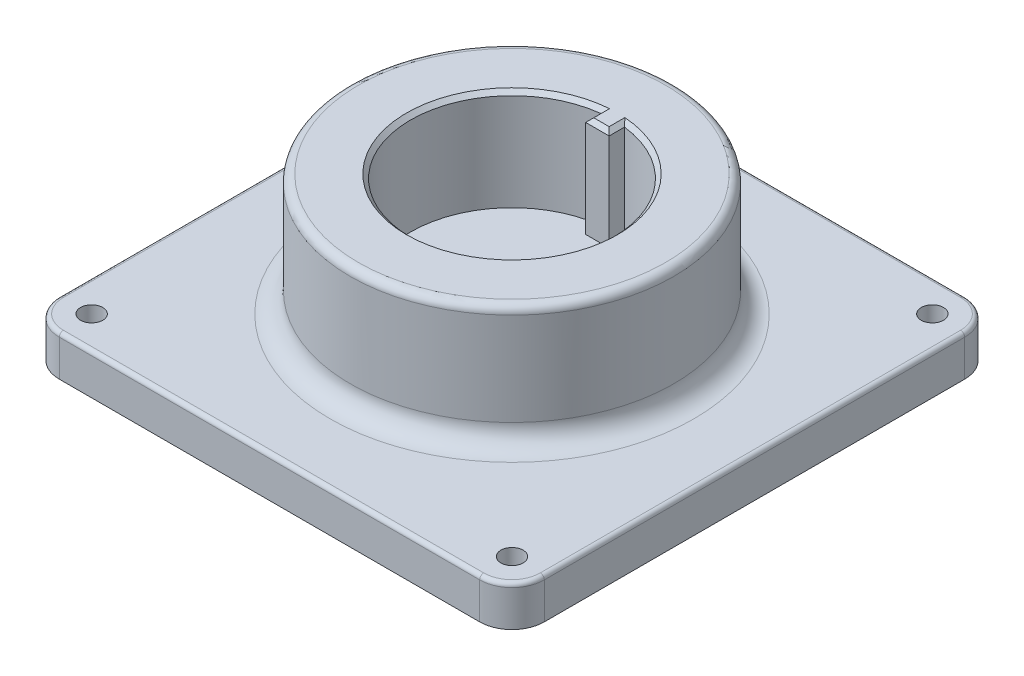
from build123d import *

# Parameters (mm, degrees)
SKETCH1_W           = 120
SKETCH1_H           = 120
BOSS_EXTRUDE1_DEPTH = 10
SKETCH2_R           = 2.75
CUT_EXTRUDE1_DEPTH  = 86.440037453
CIRPATTERN1_COUNT   = 4
FILLET1_R           = 8
FILLET2_R           = 1
SKETCH3_R           = 40
BOSS_EXTRUDE2_DEPTH = 30
SKETCH4_R           = 25.1
CUT_EXTRUDE2_DEPTH  = 25
BOSS_EXTRUDE3_REACH = 95.808
CHAMFER1_SIZE       = 1
FILLET3_R           = 2
FILLET4_R           = 5


with BuildPart() as part:
    # Sketch1 → Boss-Extrude1 (new body)
    with BuildSketch(Plane(origin=(0, 0, 0), x_dir=(1, 0, 0), z_dir=(0, 1, 0))):
        Rectangle(SKETCH1_W, SKETCH1_H)
    extrude(amount=BOSS_EXTRUDE1_DEPTH)

    # Sketch2 → Cut-Extrude1 (cut, through all)
    with BuildSketch(Plane(origin=(0, 10, 0), x_dir=(1, 0, 0), z_dir=(0, 1, 0))):
        with Locations((-52, 52)):
            Circle(SKETCH2_R)
    cut_extrude1 = extrude(amount=-CUT_EXTRUDE1_DEPTH, mode=Mode.SUBTRACT)

    # CirPattern1: Cut-Extrude1 ×4 about axis
    cirpattern1_axis = Axis((0, 0, 0), (0, 1, 0))
    for i in range(1, CIRPATTERN1_COUNT):
        add(cut_extrude1.rotate(cirpattern1_axis, i * 360 / CIRPATTERN1_COUNT), mode=Mode.SUBTRACT)

    # Fillet1
    fillet1_edges = [part.edges().sort_by_distance(p)[0] for p in [
        (-60, 5, 60),
        (60, 5, 60),
        (60, 5, -60),
        (-60, 5, -60),
    ]]
    fillet(fillet1_edges, radius=FILLET1_R)

    # Fillet2
    fillet2_edges = [part.edges().sort_by_distance(p)[0] for p in [
        (-57.656854249, 10, -57.656854249),
        (0, 10, -60),
        (57.656854249, 10, -57.656854249),
        (60, 10, 0),
        (57.656854249, 10, 57.656854249),
        (0, 10, 60),
        (-57.656854249, 10, 57.656854249),
        (-60, 10, 0),
    ]]
    fillet(fillet2_edges, radius=FILLET2_R)

    # Sketch3 → Boss-Extrude2 (add)
    with BuildSketch(Plane(origin=(0, 10, 0), x_dir=(1, 0, 0), z_dir=(0, 1, 0))):
        Circle(SKETCH3_R)
    extrude(amount=BOSS_EXTRUDE2_DEPTH)

    # Sketch4 → Cut-Extrude2 (cut)
    with BuildSketch(Plane(origin=(0, 40, 0), x_dir=(1, 0, 0), z_dir=(0, 1, 0))):
        Circle(SKETCH4_R)
    extrude(amount=-CUT_EXTRUDE2_DEPTH, mode=Mode.SUBTRACT)

    # Sketch5 → Boss-Extrude3 (add, up to next)
    with BuildSketch(Plane(origin=(0, 40, 0), x_dir=(1, 0, 0), z_dir=(0, 1, 0)), mode=Mode.PRIVATE) as boss_extrude3_sk1:
        with BuildLine():
            Line((2.9, 21.131907268), (-2.9, 21.131907268))
            Line((-2.9, 21.131907268), (-2.9, 24.931907268))
            ThreePointArc((-2.9, 24.931907268), (0, 25.1), (2.9, 24.931907268))
            Line((2.9, 24.931907268), (2.9, 21.131907268))
        make_face()
    boss_extrude3_tool1 = extrude(boss_extrude3_sk1.sketch, amount=-BOSS_EXTRUDE3_REACH, mode=Mode.PRIVATE) - part.part
    add(boss_extrude3_tool1.solids().sort_by_distance((0, 40, -23.088296))[0])

    # Chamfer1
    chamfer1_edges = [part.edges().sort_by_distance(p)[0] for p in [
        (-2.9, 40, -23.031907268),
        (0, 40, -21.131907268),
        (2.9, 40, -23.031907268),
        (0, 40, 25.1),
    ]]
    chamfer(chamfer1_edges, length=CHAMFER1_SIZE)

    # Fillet3
    fillet3_edges = [part.edges().sort_by_distance(p)[0] for p in [
        (-40, 40, 0),
    ]]
    fillet(fillet3_edges, radius=FILLET3_R)

    # Fillet4
    fillet4_edges = [part.edges().sort_by_distance(p)[0] for p in [
        (-40, 10, 0),
    ]]
    fillet(fillet4_edges, radius=FILLET4_R)


solid = part.part
